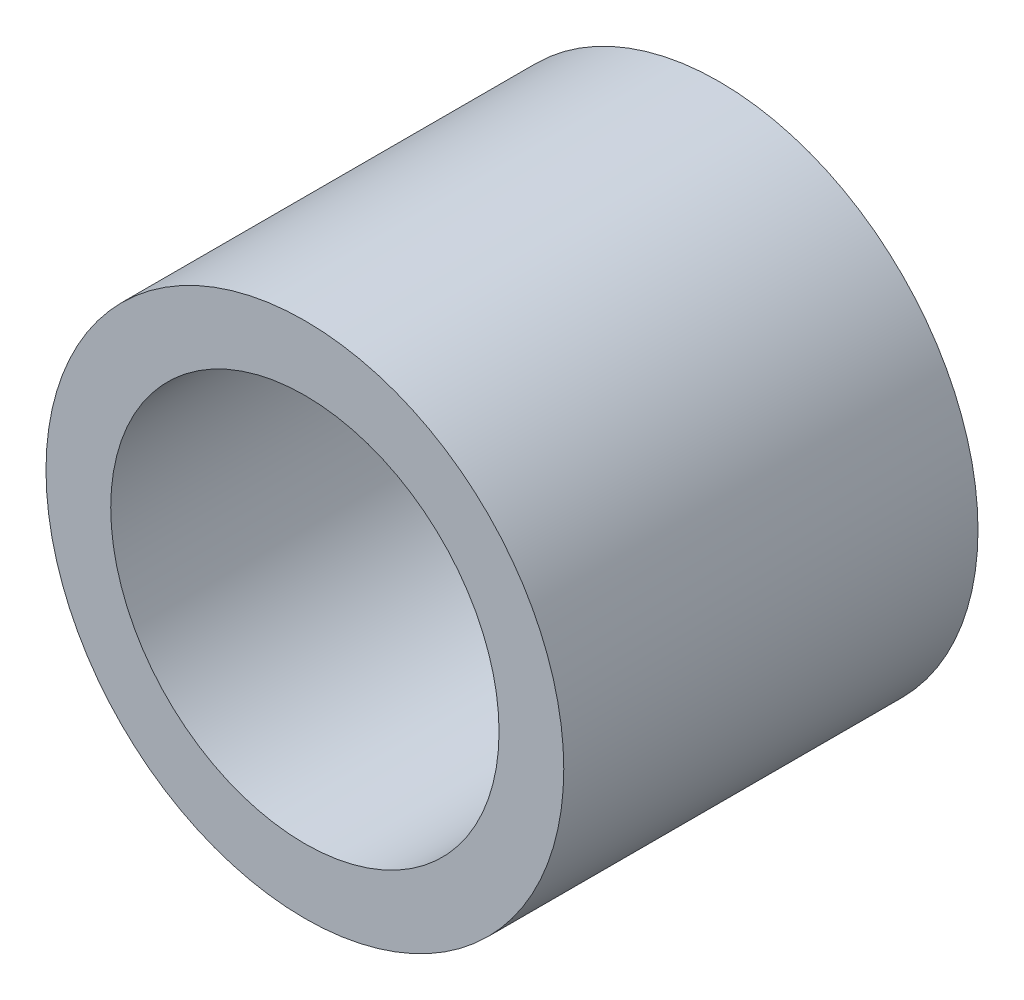
from build123d import *

# Parameters (mm, degrees)
SKETCH2_R           = 2
SKETCH2_R_2         = 1.5
BOSS_EXTRUDE1_DEPTH = 3.2


with BuildPart() as part:
    # Sketch2 → Boss-Extrude1 (new body)
    with BuildSketch(Plane.XY):
        Circle(SKETCH2_R)
        Circle(SKETCH2_R_2, mode=Mode.SUBTRACT)
    extrude(amount=BOSS_EXTRUDE1_DEPTH)


solid = part.part
